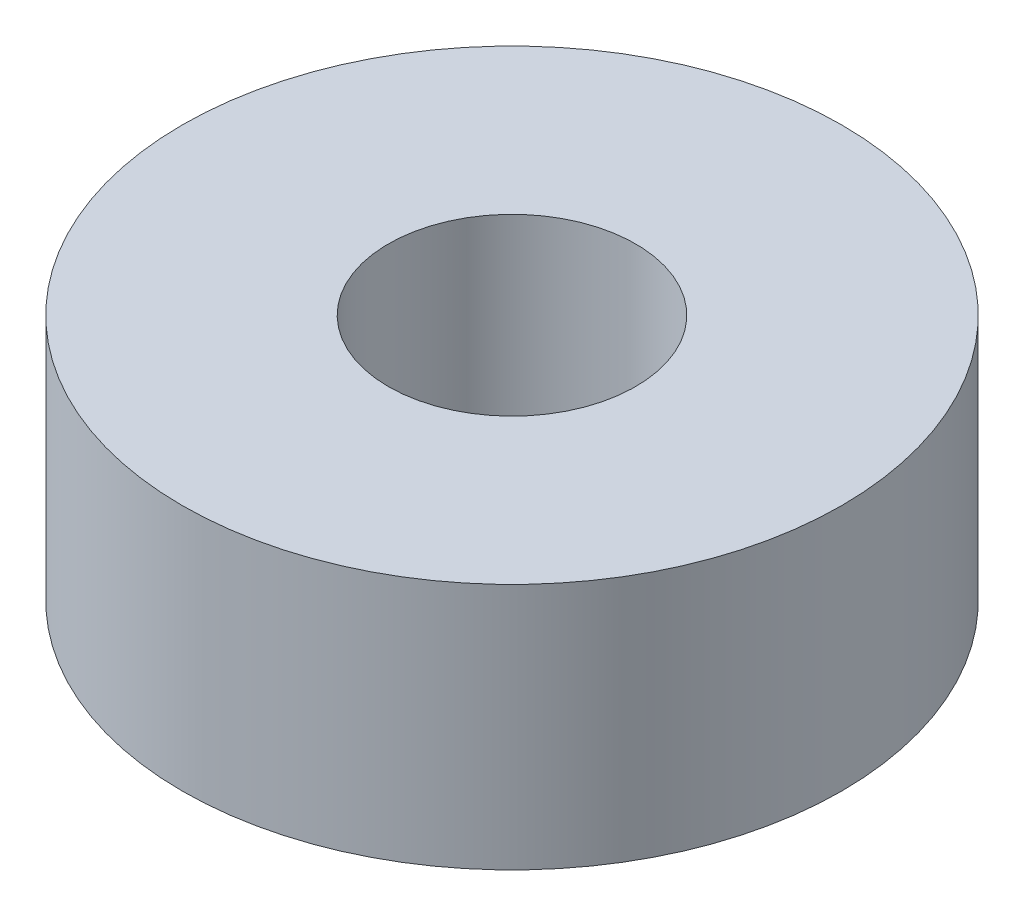
from build123d import *

# Parameters (mm, degrees)
SKETCH_1_R      = 8
SKETCH_1_R_2    = 3
EXTRUDE_1_DEPTH = 6


with BuildPart() as part:
    # 草图1 → 凸台-拉伸1 (new body)
    with BuildSketch(Plane(origin=(0, 0, 0), x_dir=(1, 0, 0), z_dir=(0, 1, 0))):
        with Locations(Location((0, 0, 0), (0, 0, 270))):
            Circle(SKETCH_1_R)
        with Locations(Location((0, 0, 0), (0, 0, 270))):
            Circle(SKETCH_1_R_2, mode=Mode.SUBTRACT)
    extrude(amount=EXTRUDE_1_DEPTH)


solid = part.part
